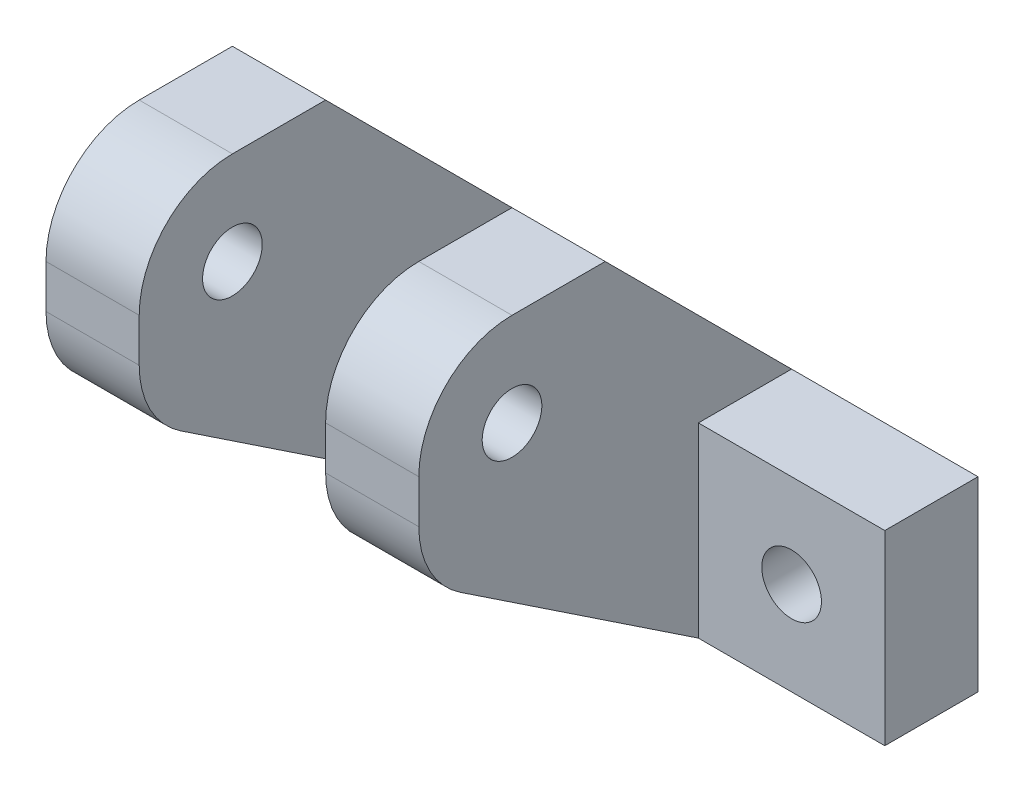
from build123d import *

# Parameters (mm, degrees)
SKETCH1_W           = 40
SKETCH1_H           = 10
BOSS_EXTRUDE1_DEPTH = 5
SKETCH2_W           = 5
SKETCH2_H           = 10
BOSS_EXTRUDE2_DEPTH = 15
SKETCH4_R           = 1.6
CUT_EXTRUDE2_DEPTH  = 15
SKETCH5_W           = 5
SKETCH5_H           = 20
BOSS_EXTRUDE3_DEPTH = 10
CUT_EXTRUDE3_REACH  = 41.051
SKETCH6_R           = 1.6
CUT_EXTRUDE4_REACH  = 41.051
FILLET2_R           = 5
CUT_EXTRUDE5_REACH  = 41.051


with BuildPart() as part:
    # Sketch1 → Boss-Extrude1 (new body)
    with BuildSketch(Plane.XY):
        Rectangle(SKETCH1_W, SKETCH1_H)
    extrude(amount=BOSS_EXTRUDE1_DEPTH)

    # Sketch2 → Boss-Extrude2 (add)
    with BuildSketch(Plane.XY.offset(5)):
        with Locations((-7.5, 0)):
            Rectangle(SKETCH2_W, SKETCH2_H)
        with Locations((7.5, 0)):
            Rectangle(SKETCH2_W, SKETCH2_H)
    extrude(amount=BOSS_EXTRUDE2_DEPTH)

    # Sketch4 → Cut-Extrude2 (cut)
    with BuildSketch(Plane(origin=(0, 0, 0), x_dir=(-1, 0, 0), z_dir=(0, 0, -1))):
        with Locations((-15, 0)):
            Circle(SKETCH4_R)
        with Locations(Location((15, 0, 0), (0, 0, 180))):
            Circle(SKETCH4_R)
    extrude(amount=-CUT_EXTRUDE2_DEPTH, mode=Mode.SUBTRACT)

    # Sketch5 → Boss-Extrude3 (add)
    with BuildSketch(Plane(origin=(0, 5, 0), x_dir=(1, 0, 0), z_dir=(0, 1, 0))):
        with Locations((-7.5, -10)):
            Rectangle(SKETCH5_W, SKETCH5_H)
        with Locations((7.5, -10)):
            Rectangle(SKETCH5_W, SKETCH5_H)
    extrude(amount=BOSS_EXTRUDE3_DEPTH)

    # Cut-Extrude3: up to this face of the body (flat: up to its plane)
    cut_extrude3_end = Plane(part.part.faces().sort_by_distance((10, 5.714285714, 11.071428571))[0])
    # Sketch6 → Cut-Extrude3 (cut, up to the picked face)
    with BuildSketch(Plane.ZY.offset(10), mode=Mode.PRIVATE) as cut_extrude3_sk1:
        with Locations((15, 10)):
            Circle(SKETCH6_R)
    cut_extrude3_tool1 = split(extrude(cut_extrude3_sk1.sketch, amount=-CUT_EXTRUDE3_REACH, mode=Mode.PRIVATE), bisect_by=cut_extrude3_end, keep=Keep.BOTH, mode=Mode.PRIVATE)
    add(cut_extrude3_tool1.solids().sort_by(Axis((-10, 10, 15), (1, 0, 0)))[0], mode=Mode.SUBTRACT)

    # Cut-Extrude4: up to this face of the body (flat: up to its plane)
    cut_extrude4_end = Plane(part.part.faces().sort_by_distance((10, 5.613490273, 10.97903275))[0])
    # Sketch7 → Cut-Extrude4 (cut, up to the picked face)
    with BuildSketch(Plane.ZY.offset(10), mode=Mode.PRIVATE) as cut_extrude4_sk1:
        Polygon((20, 5), (5, -5), (20, -5), align=None)
    cut_extrude4_tool1 = split(extrude(cut_extrude4_sk1.sketch, amount=-CUT_EXTRUDE4_REACH, mode=Mode.PRIVATE), bisect_by=cut_extrude4_end, keep=Keep.BOTH, mode=Mode.PRIVATE)
    add(cut_extrude4_tool1.solids().sort_by(Axis((-10, -1.666667, 15), (1, 0, 0)))[0], mode=Mode.SUBTRACT)

    # Fillet2
    fillet2_edges = [part.edges().sort_by_distance(p)[0] for p in [
        (-7.5, 15, 20),
        (7.5, 15, 20),
        (-7.5, 5, 20),
        (7.5, 5, 20),
    ]]
    fillet(fillet2_edges, radius=FILLET2_R)

    # Cut-Extrude5: up to this face of the body (flat: up to its plane)
    cut_extrude5_end = Plane(part.part.faces().sort_by_distance((10, 7.540739084, 9.622610051))[0])
    # Sketch8 → Cut-Extrude5 (cut, up to the picked face)
    with BuildSketch(Plane.ZY.offset(10), mode=Mode.PRIVATE) as cut_extrude5_sk1:
        Polygon((0, 5), (10, 15), (0, 15), align=None)
    cut_extrude5_tool1 = split(extrude(cut_extrude5_sk1.sketch, amount=-CUT_EXTRUDE5_REACH, mode=Mode.PRIVATE), bisect_by=cut_extrude5_end, keep=Keep.BOTH, mode=Mode.PRIVATE)
    add(cut_extrude5_tool1.solids().sort_by(Axis((-10, 11.666667, 3.333333), (1, 0, 0)))[0], mode=Mode.SUBTRACT)


solid = part.part
